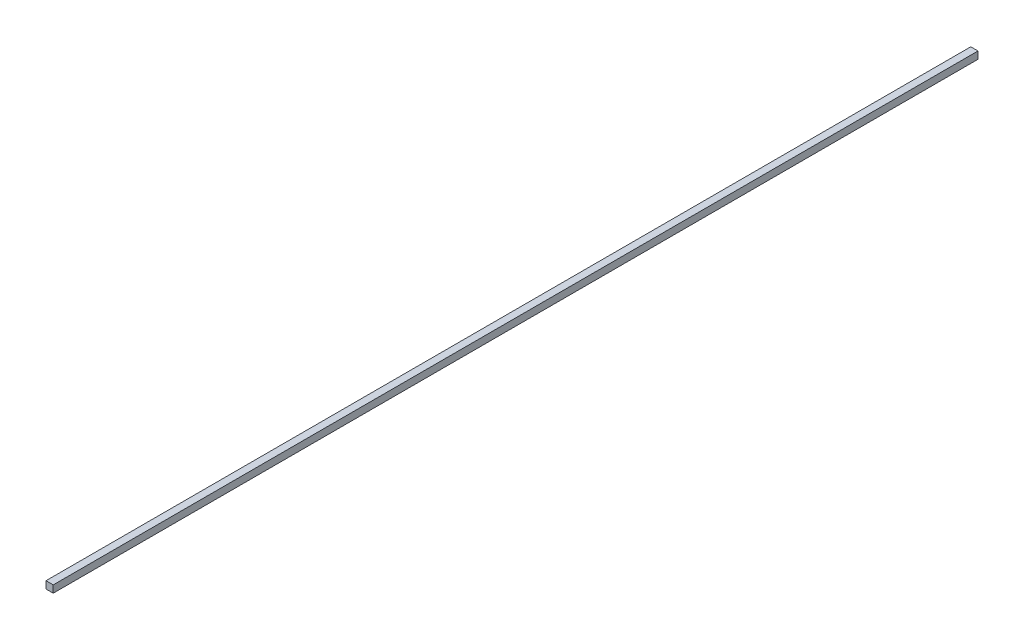
from build123d import *

# Parameters (mm, degrees)
SKETCH1_W      = 2.38125
SKETCH1_H      = 2.38125
EXTRUDE1_DEPTH = 304.8


with BuildPart() as part:
    # Sketch1 → Extrude1 (new body)
    with BuildSketch(Plane.XY):
        Rectangle(SKETCH1_W, SKETCH1_H)
    extrude(amount=-EXTRUDE1_DEPTH)


solid = part.part
